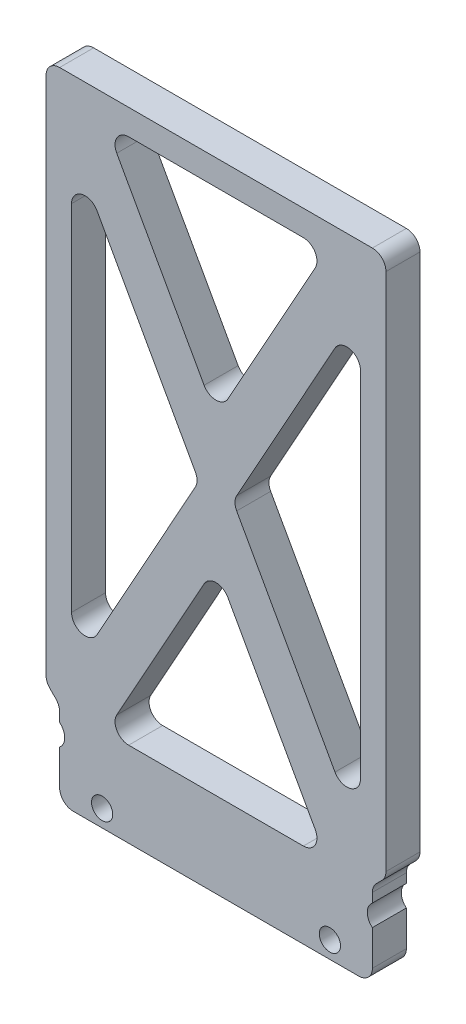
from build123d import *

# Parameters (mm, degrees)
CROQUIS1_W              = 40
CROQUIS1_H              = 75
CROQUIS1_R              = 1.25
SALIENTE_EXTRUIR1_DEPTH = 4
CORTAR_EXTRUIR1_DEPTH   = 4
CORTAR_EXTRUIR2_DEPTH   = 4
CROQUIS4_R              = 1.6
CORTAR_EXTRUIR3_DEPTH   = 4
REDONDEO2_R             = 1.6


with BuildPart() as part:
    # Croquis1 → Saliente-Extruir1 (new body)
    with BuildSketch(Plane.XY):
        with Locations((5, -13.156453444)):
            Rectangle(CROQUIS1_W, CROQUIS1_H)
        with Locations((-8.4, -48.656453444)):
            Circle(CROQUIS1_R, mode=Mode.SUBTRACT)
        with Locations(Location((18.4, -48.656453444, 0), (0, 0, 180))):
            Circle(CROQUIS1_R, mode=Mode.SUBTRACT)
    extrude(amount=SALIENTE_EXTRUIR1_DEPTH)

    # Croquis2 → Cortar-Extruir1 (cut)
    with BuildSketch(Plane.XY.offset(4)):
        Polygon((-12, -36.656453444), (3, -9.656453444), (-12, 17.343546556), align=None)
        Polygon((-8, -40.656453444), (5, -17.256453444), (18, -40.656453444), align=None)
        Polygon((18, 21.343546556), (5, -2.056453444), (-8, 21.343546556), align=None)
        Polygon((22, 17.343546556), (7, -9.656453444), (22, -36.656453444), align=None)
    extrude(amount=-CORTAR_EXTRUIR1_DEPTH, mode=Mode.SUBTRACT)

    # Croquis3 → Cortar-Extruir2 (cut)
    with BuildSketch(Plane.XY.offset(4)):
        Polygon((-13.4, -50.656453444), (-15, -50.656453444), (-15, -40.656453444), (-15, -39.056453444), (-13.4, -40.656453444), align=None)
        Polygon((25, -50.656453444), (25, -40.656453444), (25, -39.056453444), (23.4, -40.656453444), (23.4, -50.656453444), align=None)
    extrude(amount=-CORTAR_EXTRUIR2_DEPTH, mode=Mode.SUBTRACT)

    # Croquis4 → Cortar-Extruir3 (cut)
    with BuildSketch(Plane.XY.offset(4)):
        with Locations((-14.4, -43.656453444)):
            Circle(CROQUIS4_R)
        with Locations((24.4, -43.656453444)):
            Circle(CROQUIS4_R)
    extrude(amount=-CORTAR_EXTRUIR3_DEPTH, mode=Mode.SUBTRACT)

    # Redondeo2
    redondeo2_edges = [part.edges().sort_by_distance(p)[0] for p in [
        (18, -40.656453444, 2),
        (-8, -40.656453444, 2),
        (5, -17.256453444, 2),
        (-8, 21.343546556, 2),
        (18, 21.343546556, 2),
        (5, -2.056453444, 2),
        (22, 17.343546556, 2),
        (22, -36.656453444, 2),
        (7, -9.656453444, 2),
        (-12, -36.656453444, 2),
        (-12, 17.343546556, 2),
        (3, -9.656453444, 2),
        (-15, 24.343546556, 2),
        (25, 24.343546556, 2),
        (-13.4, -40.656453444, 2),
        (-13.4, -50.656453444, 2),
        (-15, -39.056453444, 2),
        (23.4, -50.656453444, 2),
        (23.4, -40.656453444, 2),
        (25, -39.056453444, 2),
    ]]
    fillet(redondeo2_edges, radius=REDONDEO2_R)


solid = part.part
